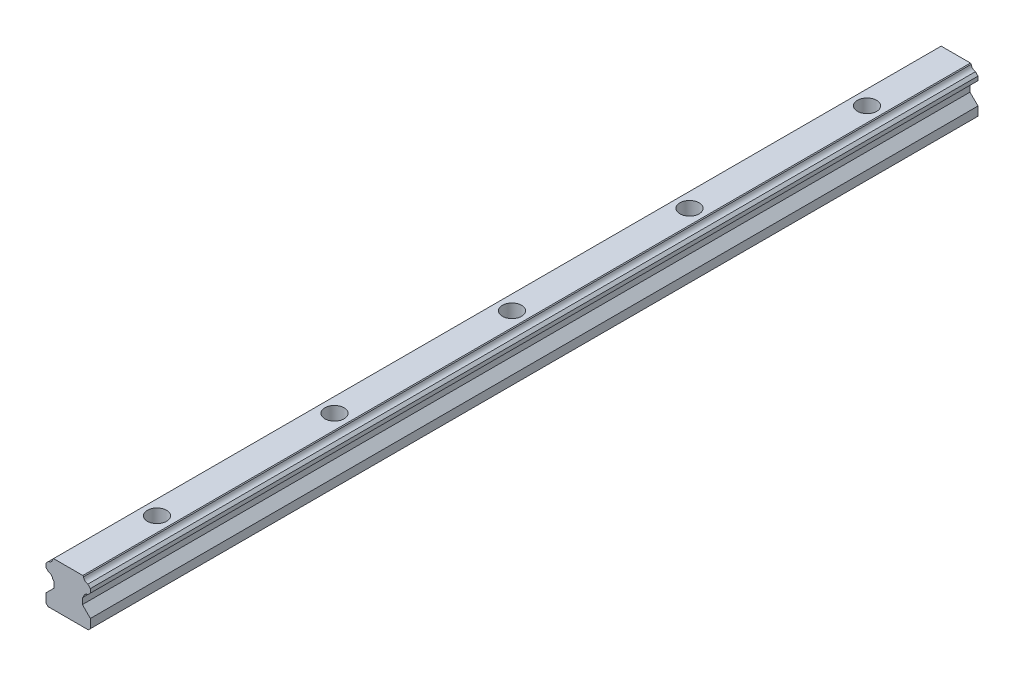
from build123d import *

# Parameters (mm, degrees)
EXTRUDE_1_DEPTH     = 300
SKETCH_2_R          = 3.25
CUT_EXTRUDE_1_DEPTH = 5.3
SKETCH_3_R          = 2.25
CUT_EXTRUDE_2_DEPTH = 301.250462115


with BuildPart() as part:
    # Model → Бобышка-Вытянуть1 (new body)
    with BuildSketch(Plane.XY):
        with BuildLine():
            Line((6.8, 0), (7.5, 0.7))
            Line((7.5, 0.7), (7.5, 3.6994391))
            Line((7.5, 3.6994391), (4.7998047, 6.3996344))
            Line((4.7998047, 6.3996344), (4.7998047, 8.409149262))
            Line((4.7998047, 8.409149262), (5.20075838, 8.810103152))
            ThreePointArc((5.20075838, 8.810103152), (5.668922208, 9.789261508), (6.648080611, 10.257425237))
            Line((6.648080611, 10.257425237), (7.5, 11.109345046))
            Line((7.5, 11.109345046), (7.5, 12.449454443))
            Line((7.5, 12.449454443), (6.634490912, 13.314965186))
            ThreePointArc((6.634490912, 13.314965186), (5.668922174, 13.781617126), (5.202270193, 14.747185846))
            Line((5.202270193, 14.747185846), (4.949456226, 15))
            Line((4.949456226, 15), (-4.949456226, 15))
            Line((-4.949456226, 15), (-5.202270193, 14.747185846))
            ThreePointArc((-5.202270193, 14.747185846), (-5.668922174, 13.781617126), (-6.634490912, 13.314965186))
            Line((-6.634490912, 13.314965186), (-7.5, 12.449454443))
            Line((-7.5, 12.449454443), (-7.5, 11.109345046))
            Line((-7.5, 11.109345046), (-6.648080611, 10.257425238))
            ThreePointArc((-6.648080611, 10.257425238), (-5.668922208, 9.789261508), (-5.20075838, 8.810103152))
            Line((-5.20075838, 8.810103152), (-4.7998047, 8.409149262))
            Line((-4.7998047, 8.409149262), (-4.7998047, 6.3996344))
            Line((-4.7998047, 6.3996344), (-7.5, 3.6994391))
            Line((-7.5, 3.6994391), (-7.5, 0.7))
            Line((-7.5, 0.7), (-6.8, 0))
            Line((-6.8, 0), (6.8, 0))
        make_face()
    extrude(amount=EXTRUDE_1_DEPTH)

    # Эскиз2 → Вырез-Вытянуть1 (cut)
    with BuildSketch(Plane(origin=(0, 15, 0), x_dir=(1, 0, 0), z_dir=(0, 1, 0))):
        with Locations(Location((0, -30, 0), (0, 0, 180))):
            Circle(SKETCH_2_R)
        with Locations(Location((0, -90, 0), (0, 0, 180))):
            Circle(SKETCH_2_R)
        with Locations(Location((0, -150, 0), (0, 0, 180))):
            Circle(SKETCH_2_R)
        with Locations(Location((0, -210, 0), (0, 0, 180))):
            Circle(SKETCH_2_R)
        with Locations(Location((0, -270, 0), (0, 0, 180))):
            Circle(SKETCH_2_R)
        with Locations((0, -330)):
            Circle(SKETCH_2_R)
        with Locations((0, -390)):
            Circle(SKETCH_2_R)
        with Locations((0, -450)):
            Circle(SKETCH_2_R)
        with Locations((0, -510)):
            Circle(SKETCH_2_R)
        with Locations((0, -570)):
            Circle(SKETCH_2_R)
    extrude(amount=-CUT_EXTRUDE_1_DEPTH, mode=Mode.SUBTRACT)

    # Эскиз3 → Вырез-Вытянуть2 (cut, through all)
    with BuildSketch(Plane(origin=(0, 9.7, 0), x_dir=(1, 0, 0), z_dir=(0, 1, 0))):
        with Locations(Location((0, -30, 0), (0, 0, 180))):
            Circle(SKETCH_3_R)
        with Locations(Location((0, -90, 0), (0, 0, 180))):
            Circle(SKETCH_3_R)
        with Locations(Location((0, -150, 0), (0, 0, 180))):
            Circle(SKETCH_3_R)
        with Locations(Location((0, -210, 0), (0, 0, 180))):
            Circle(SKETCH_3_R)
        with Locations(Location((0, -270, 0), (0, 0, 180))):
            Circle(SKETCH_3_R)
        with Locations((0, -330)):
            Circle(SKETCH_3_R)
        with Locations((0, -390)):
            Circle(SKETCH_3_R)
        with Locations((0, -450)):
            Circle(SKETCH_3_R)
        with Locations((0, -510)):
            Circle(SKETCH_3_R)
        with Locations((0, -570)):
            Circle(SKETCH_3_R)
    extrude(amount=-CUT_EXTRUDE_2_DEPTH, mode=Mode.SUBTRACT)


solid = part.part
